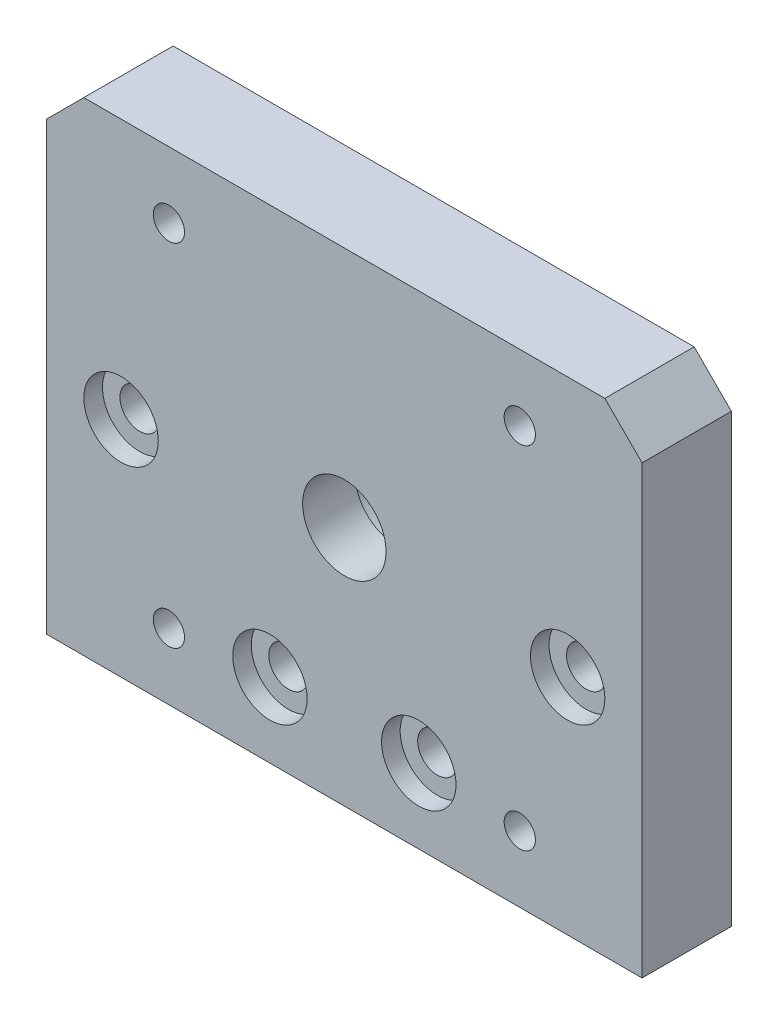
from build123d import *

# Parameters (mm, degrees)
BOSS_EXTRUDE1_DEPTH                                 = 12
M5_TAPPED_HOLE1_D                                   = 4.2
CBORE_FOR_M5_HEX_SOCKET_HEAD_CAP_SCREW1_D           = 5.3
CBORE_FOR_M5_HEX_SOCKET_HEAD_CAP_SCREW1_CBORE_D     = 10
CBORE_FOR_M5_HEX_SOCKET_HEAD_CAP_SCREW1_CBORE_DEPTH = 2.5
SKETCH8_R                                           = 5.6
CUT_EXTRUDE1_DEPTH                                  = 12
SKETCH9_R                                           = 8
CUT_EXTRUDE2_DEPTH                                  = 5


with BuildPart() as part:
    # Sketch3 → Boss-Extrude1 (new body)
    with BuildSketch(Plane.XY):
        Polygon((-40, -32.4), (40, -32.4), (40, 27.54), (35, 32.54), (-35, 32.54), (-40, 27.54), align=None)
    extrude(amount=BOSS_EXTRUDE1_DEPTH)

    # M5 Tapped Hole1 (through all)
    with Locations(Plane.XY.offset(12)):
        with Locations((-23.57, -23.5), (-23.57, 23.64), (23.57, 23.64), (23.57, -23.5)):
            Hole(M5_TAPPED_HOLE1_D / 2)

    # CBORE for M5 Hex Socket Head Cap Screw1 (through all)
    with Locations(Plane.XY.offset(12)):
        with Locations((-30, -2.4), (-10, -22.4), (10, -22.4), (30, -2.4)):
            CounterBoreHole(CBORE_FOR_M5_HEX_SOCKET_HEAD_CAP_SCREW1_D / 2, CBORE_FOR_M5_HEX_SOCKET_HEAD_CAP_SCREW1_CBORE_D / 2, CBORE_FOR_M5_HEX_SOCKET_HEAD_CAP_SCREW1_CBORE_DEPTH)

    # Sketch8 → Cut-Extrude1 (cut)
    with BuildSketch(Plane.XY.offset(12)):
        Circle(SKETCH8_R)
    extrude(amount=-CUT_EXTRUDE1_DEPTH, mode=Mode.SUBTRACT)

    # Sketch9 → Cut-Extrude2 (cut)
    with BuildSketch(Plane(origin=(0, 0, 0), x_dir=(-1, 0, 0), z_dir=(0, 0, -1))):
        Circle(SKETCH9_R)
    extrude(amount=-CUT_EXTRUDE2_DEPTH, mode=Mode.SUBTRACT)


solid = part.part
